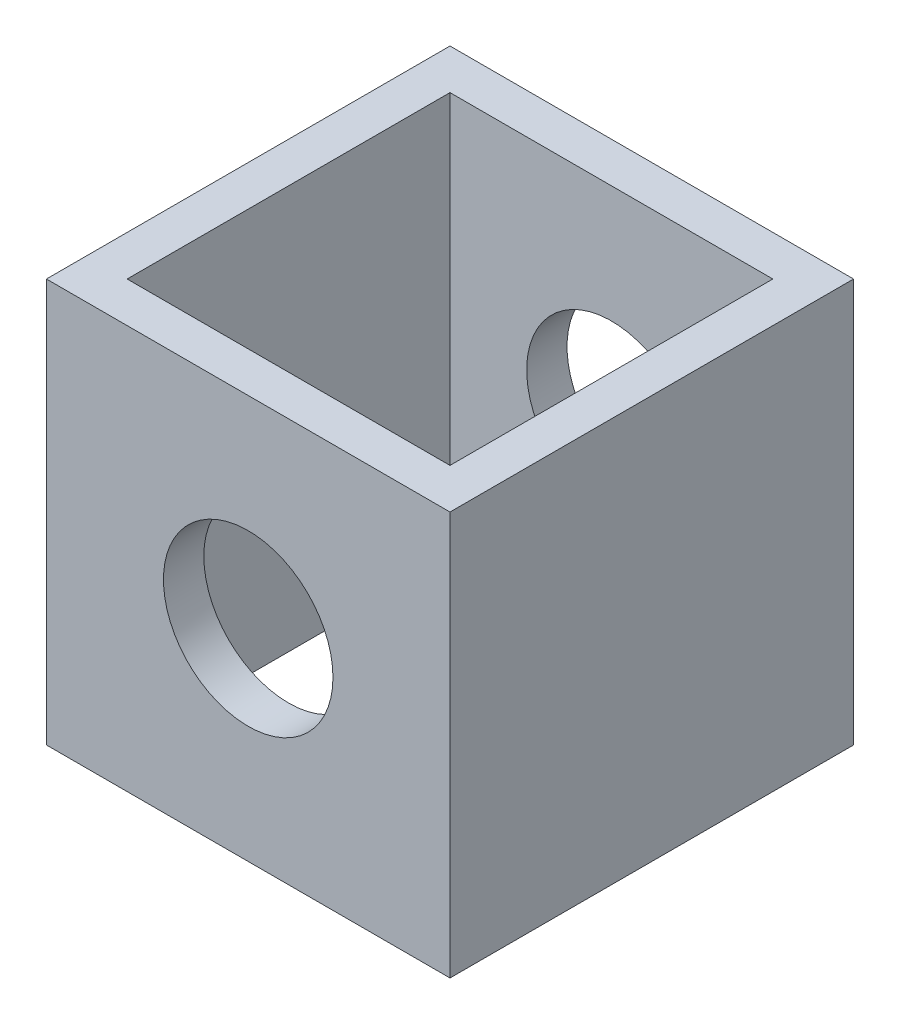
from build123d import *

# Parameters (mm, degrees)
SKETCH_1_W          = 10
SKETCH_1_H          = 10
SKETCH_1_W_2        = 8
SKETCH_1_H_2        = 8
EXTRUDE_1_DEPTH     = 10
SKETCH_2_R          = 2.1
CUT_EXTRUDE_1_DEPTH = 16


with BuildPart() as part:
    # ｽｹｯﾁ1 → 押し出し-薄板1 (new body)
    with BuildSketch(Plane(origin=(0, 0, 0), x_dir=(1, 0, 0), z_dir=(0, 1, 0))):
        Rectangle(SKETCH_1_W, SKETCH_1_H)
        Rectangle(SKETCH_1_W_2, SKETCH_1_H_2, mode=Mode.SUBTRACT)
    extrude(amount=EXTRUDE_1_DEPTH)

    # ｽｹｯﾁ2 → ｶｯﾄ - 押し出し1 (cut, through all)
    with BuildSketch(Plane.XY.offset(5)):
        with Locations((0, 5)):
            Circle(SKETCH_2_R)
    extrude(amount=-CUT_EXTRUDE_1_DEPTH, mode=Mode.SUBTRACT)


solid = part.part
